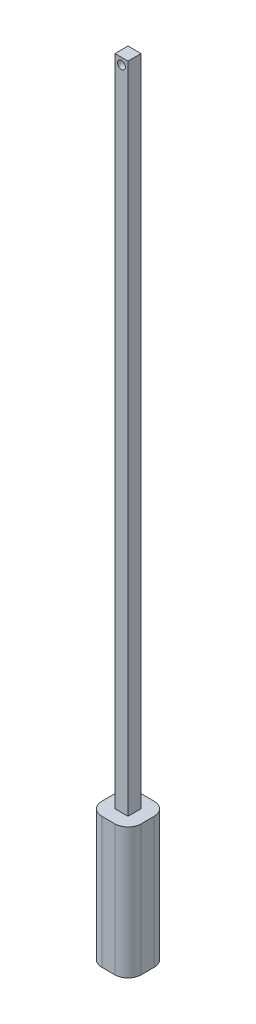
from build123d import *

# Parameters (mm, degrees)
SKETCH1_W           = 10
SKETCH1_H           = 500
SKETCH1_R           = 3
BOSS_EXTRUDE1_DEPTH = 10
SKETCH2_W           = 30
SKETCH2_H           = 30
BOSS_EXTRUDE2_DEPTH = 100
FILLET1_R           = 10


with BuildPart() as part:
    # Sketch1 → Boss-Extrude1 (new body)
    with BuildSketch(Plane.XY):
        with Locations((0, -245)):
            Rectangle(SKETCH1_W, SKETCH1_H)
        Circle(SKETCH1_R, mode=Mode.SUBTRACT)
    extrude(amount=BOSS_EXTRUDE1_DEPTH)

    # Sketch2 → Boss-Extrude2 (add)
    with BuildSketch(Plane.XZ.offset(495)):
        with Locations((0, 5)):
            Rectangle(SKETCH2_W, SKETCH2_H)
    extrude(amount=BOSS_EXTRUDE2_DEPTH)

    # Fillet1
    fillet1_edges = [part.edges().sort_by_distance(p)[0] for p in [
        (15, -545, -10),
        (15, -545, 20),
        (-15, -545, 20),
        (-15, -545, -10),
    ]]
    fillet(fillet1_edges, radius=FILLET1_R)


solid = part.part
